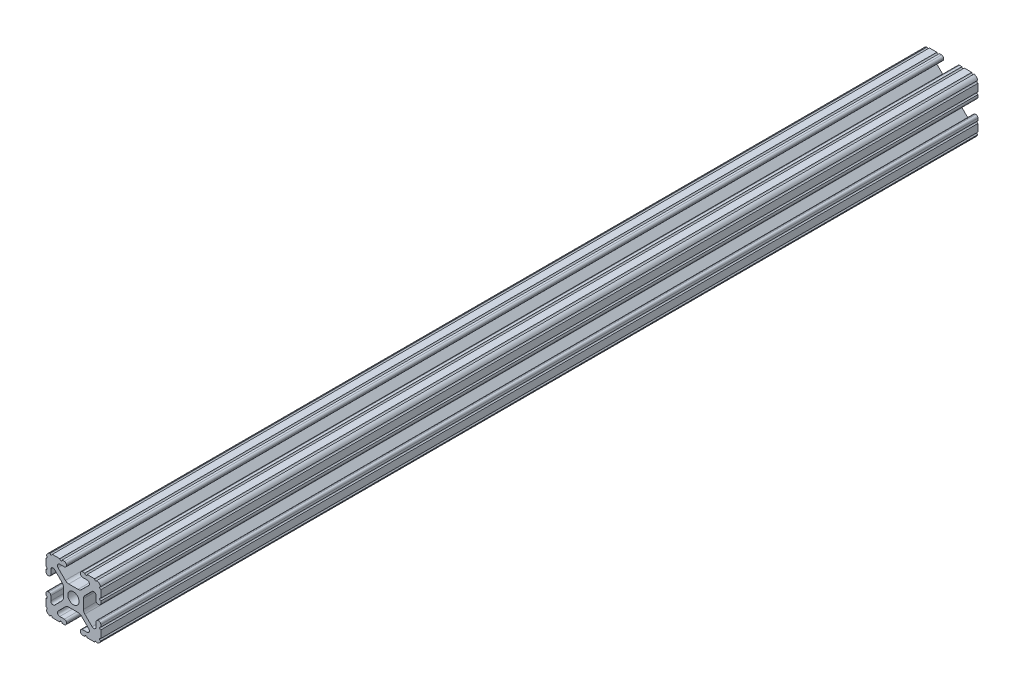
from build123d import *

# Parameters (mm, degrees)
BOSS_EXTRUDE1_DEPTH     = 203.2
CUT_EXTRUDE1_DEPTH      = 204.992205733
CUT_EXTRUDE1_DEPTH_BACK = 204.992205733
SKETCH5_R               = 0.55245


with BuildPart() as part:
    # Sketch4 → Boss-Extrude1 (new, symmetric)
    with BuildSketch(Plane.XY):
        with BuildLine():
            Line((4.190365, -12.7), (10.11729625, -12.7))
            ThreePointArc((10.11729625, -12.7), (11.943543585, -11.943543585), (12.7, -10.11729625))
            Line((12.7, -10.11729625), (12.7, -4.190365))
            ThreePointArc((12.7, -4.190365), (12.42492494, -3.52627506), (11.760835, -3.2512))
            Line((11.760835, -3.2512), (11.429365, -3.2512))
            ThreePointArc((11.429365, -3.2512), (10.76527506, -3.52627506), (10.4902, -4.190365))
            Line((10.4902, -4.190365), (10.4902, -6.348478019))
            ThreePointArc((10.4902, -6.348478019), (9.830707141, -7.335478831), (8.666460301, -7.103895736))
            Line((8.666460301, -7.103895736), (5.299899128, -3.737334563))
            ThreePointArc((5.299899128, -3.737334563), (4.817571085, -3.015479634), (4.6482, -2.16399369))
            Line((4.6482, -2.16399369), (4.6482, 0))
            Line((4.6482, 0), (2.6035, 0))
            ThreePointArc((2.6035, 0), (1.840952505, -1.840952505), (0, -2.6035))
            Line((0, -2.6035), (0, -4.6482))
            Line((0, -4.6482), (2.16399369, -4.6482))
            ThreePointArc((2.16399369, -4.6482), (3.015479634, -4.817571085), (3.737334563, -5.299899128))
            Line((3.737334563, -5.299899128), (7.103895736, -8.666460301))
            ThreePointArc((7.103895736, -8.666460301), (7.335478831, -9.830707141), (6.348478019, -10.4902))
            Line((6.348478019, -10.4902), (4.190365, -10.4902))
            ThreePointArc((4.190365, -10.4902), (3.52627506, -10.76527506), (3.2512, -11.429365))
            Line((3.2512, -11.429365), (3.2512, -11.760835))
            ThreePointArc((3.2512, -11.760835), (3.52627506, -12.42492494), (4.190365, -12.7))
        make_face()
    extrude(amount=BOSS_EXTRUDE1_DEPTH, both=True)

    # Sketch5 → Cut-Extrude1 (cut, two sides: drawn at the far end of the back side and taken through both)
    with BuildSketch(Plane.XY.offset(-CUT_EXTRUDE1_DEPTH_BACK)):
        with Locations((10.356153152, -12.7)):
            Circle(SKETCH5_R)
        with Locations((5.796028019, -12.7)):
            Circle(SKETCH5_R)
        with Locations((12.7, -10.356153152)):
            Circle(SKETCH5_R)
        with Locations((12.7, -5.796028019)):
            Circle(SKETCH5_R)
    extrude(amount=CUT_EXTRUDE1_DEPTH + CUT_EXTRUDE1_DEPTH_BACK, mode=Mode.SUBTRACT)

    # Mirror1: part across plane


with BuildPart() as part_1:
    add(part.part)
    add(part.part.mirror(Plane(origin=(0, 0, 0), x_dir=(0, 0, 1), z_dir=(1, 0, 0))))

    # Mirror2: part across plane


with BuildPart() as part_2:
    add(part_1.part)
    add(part_1.part.mirror(Plane.ZX))


solid = part_2.part
